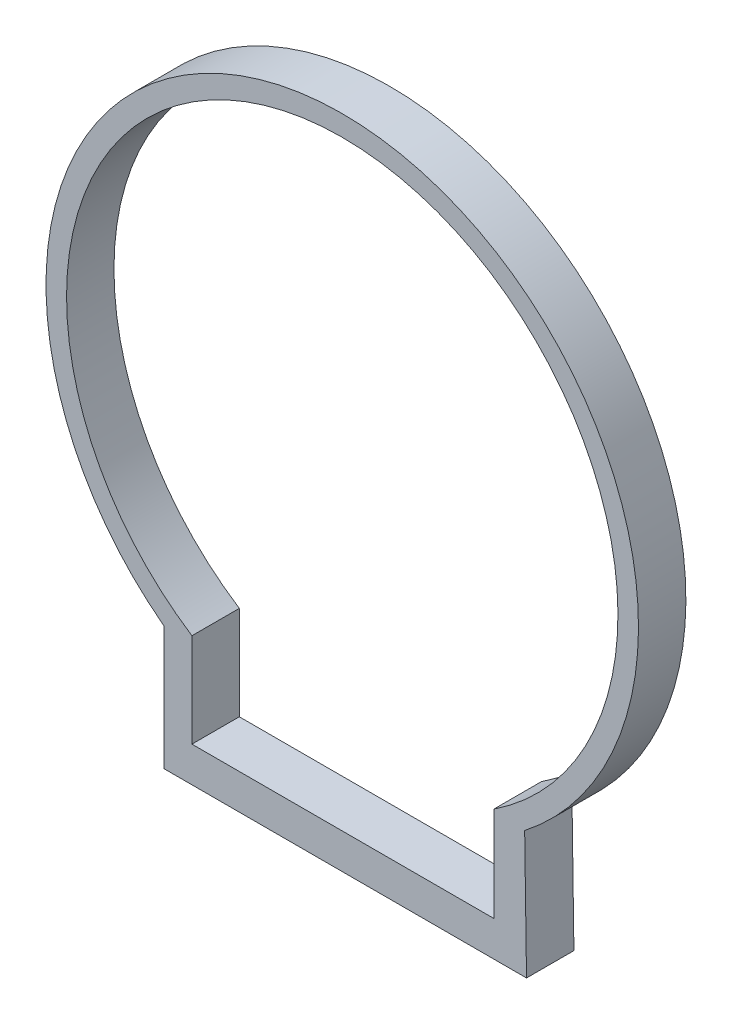
from build123d import *

# Parameters (mm, degrees)
BOSS_EXTRUDE1_DEPTH = 3
CUT_EXTRUDE1_DEPTH  = 3


with BuildPart() as part:
    # Sketch4 → Boss-Extrude1 (new body)
    with BuildSketch(Plane.XY):
        with BuildLine():
            Line((0.18777702, -22.8), (-11.28722298, -22.8))
            Line((-11.28722298, -22.8), (-11.28722298, -14.972010466))
            ThreePointArc((-11.28722298, -14.972010466), (-0.162678986, 18.749294268), (11.545314563, -14.773903061))
            Line((11.545314563, -14.773903061), (11.66277702, -22.8))
            Line((11.66277702, -22.8), (0.18777702, -22.8))
        make_face()
    extrude(amount=BOSS_EXTRUDE1_DEPTH)

    # Sketch5 → Cut-Extrude1 (cut)
    with BuildSketch(Plane.XY):
        with BuildLine():
            Line((9.593685177, -14.576134767), (9.593685177, -20.570344852))
            Line((9.593685177, -20.570344852), (-9.514830363, -20.570344852))
            Line((-9.514830363, -20.570344852), (-9.514830363, -14.627730622))
            ThreePointArc((-9.514830363, -14.627730622), (-0.047117443, 17.449936388), (9.593685177, -14.576134767))
        make_face()
    extrude(amount=CUT_EXTRUDE1_DEPTH, mode=Mode.SUBTRACT)


solid = part.part
